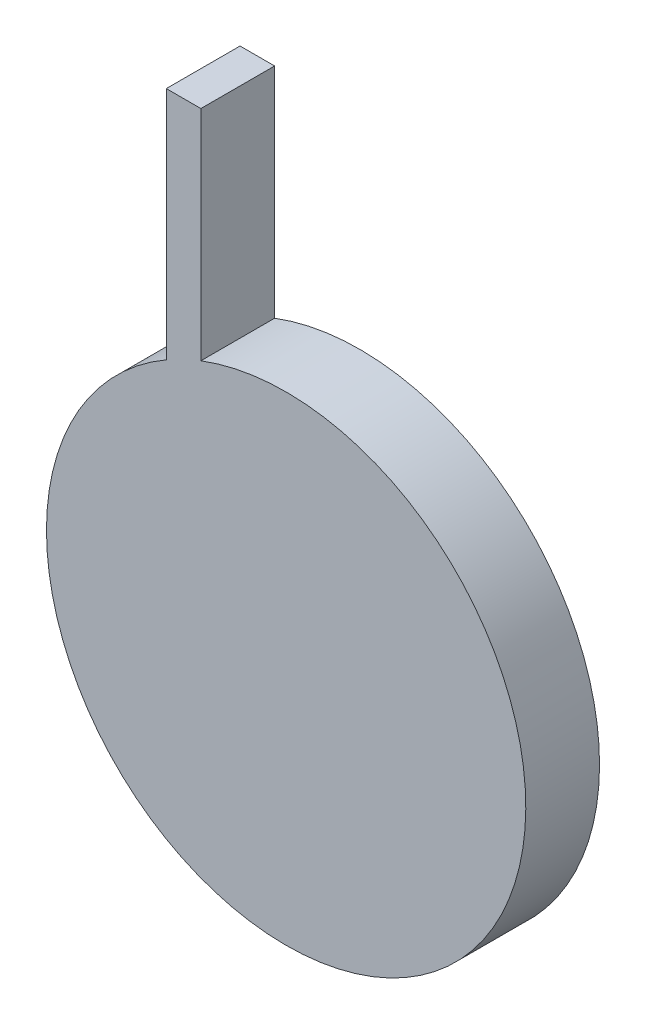
from build123d import *

# Parameters (mm, degrees)
SKETCH1_R          = 26
PLATE_DEPTH        = 8
SKETCH2_W          = 3.75
SKETCH2_H          = 28
DRIVE_LUG_DEPTH    = 8
SKETCH6_R          = 1
CUT_EXTRUDE5_DEPTH = 4.5


with BuildPart() as part:
    # Sketch1 → PLATE (new body)
    with BuildSketch(Plane.XY):
        Circle(SKETCH1_R)
    extrude(amount=PLATE_DEPTH)

    # Sketch2 → DRIVE_LUG (add)
    with BuildSketch(Plane.XY):
        with Locations((-11.125, 34)):
            Rectangle(SKETCH2_W, SKETCH2_H)
    extrude(amount=DRIVE_LUG_DEPTH)

    # Sketch6 → Cut-Extrude5 (cut)
    with BuildSketch(Plane(origin=(0, 0, 0), x_dir=(-1, 0, 0), z_dir=(0, 0, -1))):
        with Locations((11.25, 45.5)):
            Circle(SKETCH6_R)
    extrude(amount=-CUT_EXTRUDE5_DEPTH, mode=Mode.SUBTRACT)


solid = part.part
